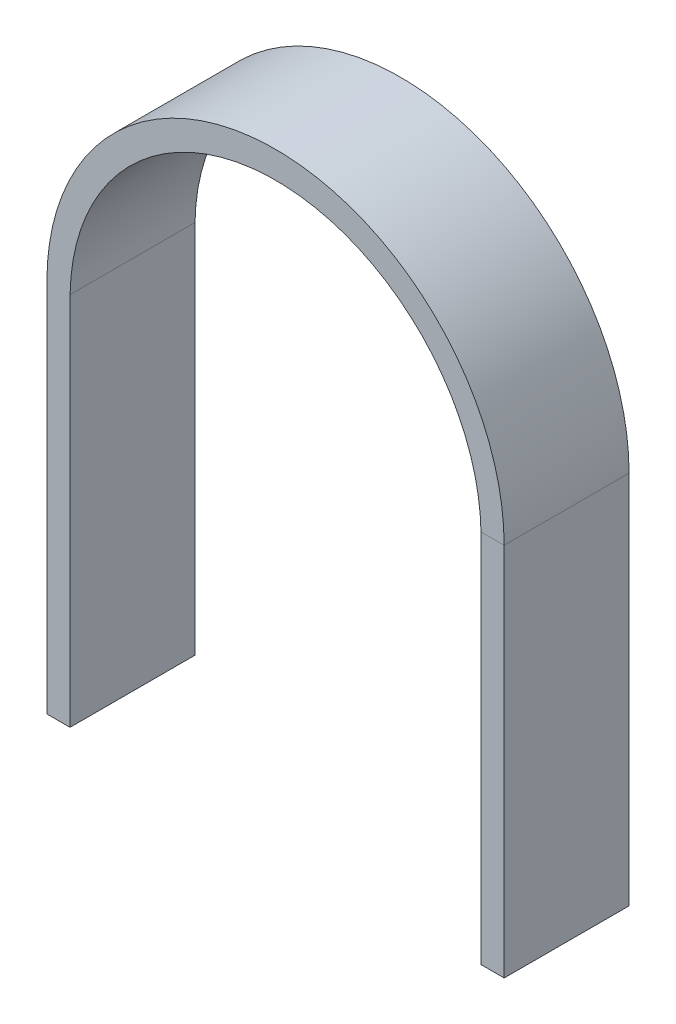
from build123d import *

# Parameters (mm, degrees)
SKETCH1_W           = 36.6
SKETCH1_H           = 10
BOSS_EXTRUDE1_DEPTH = 30
SKETCH2_W           = 32.9
SKETCH2_H           = 10
CUT_EXTRUDE1_DEPTH  = 36.494929215
BOSS_EXTRUDE3_DEPTH = 10
CUT_EXTRUDE2_DEPTH  = 17.038


with BuildPart() as part:
    # Sketch1 → Boss-Extrude1 (new body)
    with BuildSketch(Plane(origin=(0, 0, 0), x_dir=(1, 0, 0), z_dir=(0, 1, 0))):
        Rectangle(SKETCH1_W, SKETCH1_H)
    extrude(amount=BOSS_EXTRUDE1_DEPTH)

    # Sketch2 → Cut-Extrude1 (cut, through all)
    with BuildSketch(Plane(origin=(0, 0, 0), x_dir=(1, 0, 0), z_dir=(0, 1, 0))):
        Rectangle(SKETCH2_W, SKETCH2_H)
    extrude(amount=CUT_EXTRUDE1_DEPTH, mode=Mode.SUBTRACT)


with BuildPart() as cut_extrude1_piece_1:
    # of the separate pieces the step leaves, piece 1, a body of its own (cut_extrude1_pieces)
    add(part.part.solids().sort_by_distance((16.45, 0, -5))[0])


with BuildPart() as cut_extrude1_piece_2:
    # of the separate pieces the step leaves, piece 2, a body of its own (cut_extrude1_pieces)
    add(part.part.solids().sort_by_distance((-18.3, 0, -5))[0])

    # Sketch3 → Boss-Extrude3 (add)
    with BuildSketch(Plane.XY.offset(5)):
        with BuildLine():
            Line((-18.3, 30), (18.3, 30))
            ThreePointArc((18.3, 30), (0, 48.3), (-18.3, 30))
        make_face()
    extrude(amount=-BOSS_EXTRUDE3_DEPTH)

    # Sketch4 → Cut-Extrude2 (cut)
    with BuildSketch(Plane.XY.offset(5)):
        with BuildLine():
            Line((-16.45, 29.706969737), (16.45, 29.706969737))
            ThreePointArc((16.45, 29.706969737), (0, 46.156969737), (-16.45, 29.706969737))
        make_face()
    extrude(amount=-CUT_EXTRUDE2_DEPTH, mode=Mode.SUBTRACT)


solid = Compound([cut_extrude1_piece_1.part, cut_extrude1_piece_2.part])
